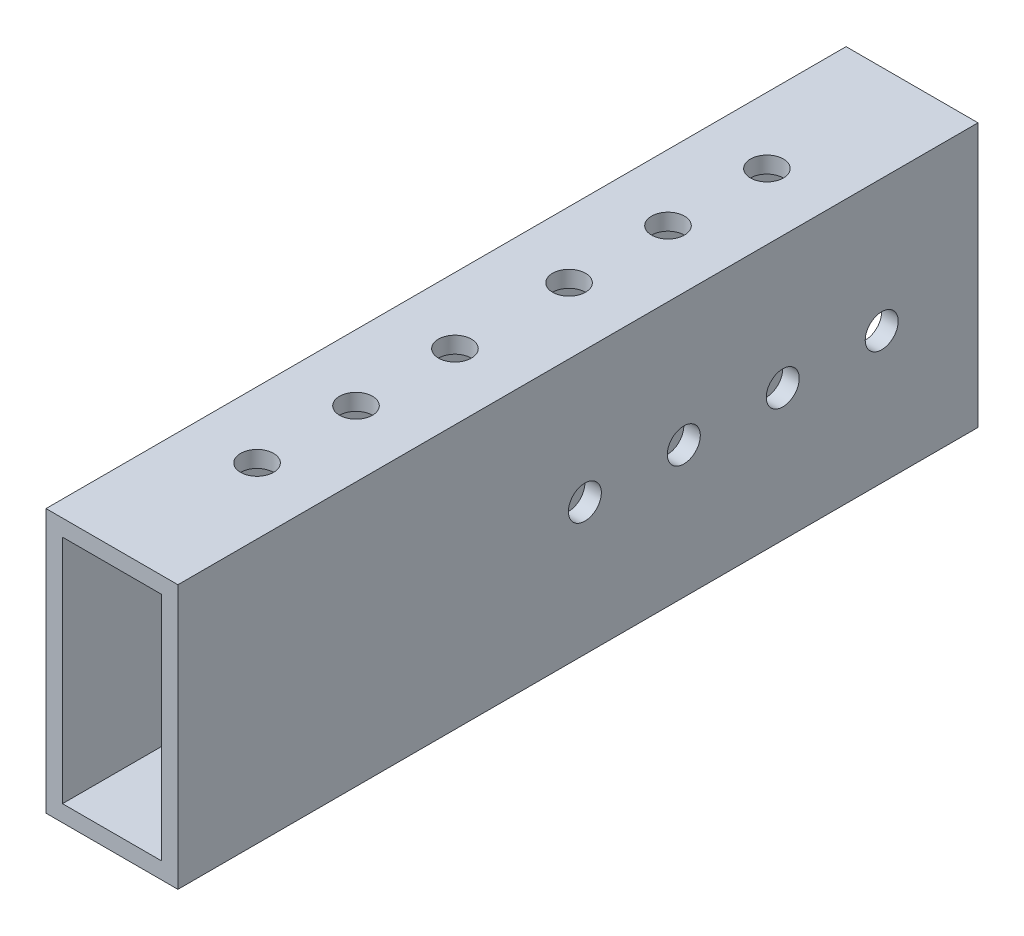
from build123d import *

# Parameters (mm, degrees)
SKETCH1_W           = 25.4
SKETCH1_H           = 50.8
SKETCH1_W_2         = 19.05
SKETCH1_H_2         = 44.45
BOSS_EXTRUDE1_DEPTH = 154.051
SKETCH2_R           = 3.175
CUT_EXTRUDE1_DEPTH  = 165.187425222
SKETCH3_R           = 3.175
CUT_EXTRUDE2_DEPTH  = 165.187425222


with BuildPart() as part:
    # Sketch1 → Boss-Extrude1 (new body)
    with BuildSketch(Plane.XY):
        with Locations((12.7, 25.4)):
            Rectangle(SKETCH1_W, SKETCH1_H)
        with Locations((12.7, 25.4)):
            Rectangle(SKETCH1_W_2, SKETCH1_H_2, mode=Mode.SUBTRACT)
    extrude(amount=BOSS_EXTRUDE1_DEPTH)

    # Sketch2 → Cut-Extrude1 (cut, through all)
    with BuildSketch(Plane(origin=(0, 50.8, 0), x_dir=(1, 0, 0), z_dir=(0, 1, 0))):
        with Locations(Location((12.7, -126.111, 0), (0, 0, 270))):
            Circle(SKETCH2_R)
        with Locations(Location((12.7, -107.061, 0), (0, 0, 270))):
            Circle(SKETCH2_R)
        with Locations(Location((12.7, -88.011, 0), (0, 0, 270))):
            Circle(SKETCH2_R)
        with Locations(Location((12.7, -27.94, 0), (0, 0, 90))):
            Circle(SKETCH2_R)
        with Locations(Location((12.7, -46.99, 0), (0, 0, 90))):
            Circle(SKETCH2_R)
        with Locations(Location((12.7, -66.04, 0), (0, 0, 90))):
            Circle(SKETCH2_R)
    extrude(amount=-CUT_EXTRUDE1_DEPTH, mode=Mode.SUBTRACT)

    # Sketch3 → Cut-Extrude2 (cut, through all)
    with BuildSketch(Plane(origin=(25.4, 0, 0), x_dir=(0, 0, -1), z_dir=(1, 0, 0))):
        with Locations(Location((-18.542, 25.4, 0), (0, 0, 90))):
            Circle(SKETCH3_R)
        with Locations(Location((-37.592, 25.4, 0), (0, 0, 90))):
            Circle(SKETCH3_R)
        with Locations(Location((-56.642, 25.4, 0), (0, 0, 90))):
            Circle(SKETCH3_R)
        with Locations(Location((-75.692, 25.4, 0), (0, 0, 90))):
            Circle(SKETCH3_R)
    extrude(amount=-CUT_EXTRUDE2_DEPTH, mode=Mode.SUBTRACT)


solid = part.part
